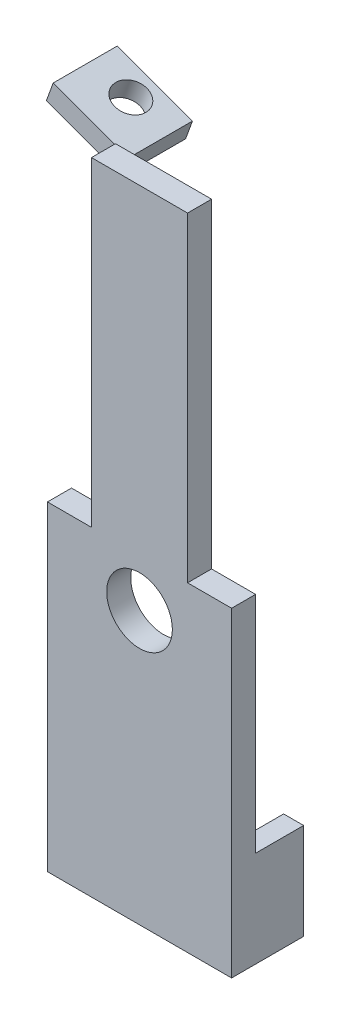
from build123d import *

# Parameters (mm, degrees)
SKETCH1_W           = 23
SKETCH1_H           = 40
BOSS_EXTRUDE1_DEPTH = 3
SKETCH2_R           = 4.1
CUT_EXTRUDE1_DEPTH  = 3
SKETCH3_W           = 12
SKETCH3_H           = 3
BOSS_EXTRUDE2_DEPTH = 40
SKETCH4_W           = 2.5
SKETCH4_H           = 12
BOSS_EXTRUDE3_DEPTH = 6
SKETCH6_W           = 8
SKETCH6_H           = 10
BOSS_EXTRUDE4_DEPTH = 2.5
SKETCH7_R           = 2
CUT_EXTRUDE2_DEPTH  = 78.511007161


with BuildPart() as part:
    # Sketch1 → Boss-Extrude1 (new body)
    with BuildSketch(Plane.XY):
        with Locations((0, 20)):
            Rectangle(SKETCH1_W, SKETCH1_H)
    extrude(amount=-BOSS_EXTRUDE1_DEPTH)

    # Sketch2 → Cut-Extrude1 (cut)
    with BuildSketch(Plane.XY):
        with Locations((0, 34)):
            Circle(SKETCH2_R)
    extrude(amount=-CUT_EXTRUDE1_DEPTH, mode=Mode.SUBTRACT)

    # Sketch3 → Boss-Extrude2 (add)
    with BuildSketch(Plane(origin=(0, 40, 0), x_dir=(1, 0, 0), z_dir=(0, 1, 0))):
        with Locations((0, 1.5)):
            Rectangle(SKETCH3_W, SKETCH3_H)
    extrude(amount=BOSS_EXTRUDE2_DEPTH)

    # Sketch4 → Boss-Extrude3 (add)
    with BuildSketch(Plane(origin=(0, 0, -3), x_dir=(-1, 0, 0), z_dir=(0, 0, -1))):
        with Locations((-10.25, 6)):
            Rectangle(SKETCH4_W, SKETCH4_H)
    extrude(amount=BOSS_EXTRUDE3_DEPTH)

    # Sketch6 → Boss-Extrude4 (add)
    with BuildSketch(Plane(origin=(24.104535363, 66.226666617, 0), x_dir=(0, 0, -1), z_dir=(0.34202014332566943, 0.9396926207859081, 0))):
        with Locations((7, 36.228956157)):
            Rectangle(SKETCH6_W, SKETCH6_H)
    extrude(amount=BOSS_EXTRUDE4_DEPTH)

    # Sketch7 → Cut-Extrude2 (cut, through all)
    with BuildSketch(Plane(origin=(24.104535363, 66.226666617, 0), x_dir=(0.9396926207859078, -0.3420201433256706, 0), z_dir=(-0.3420201433256706, -0.9396926207859078, 0))):
        with Locations((-36.228956157, -8)):
            Circle(SKETCH7_R)
    extrude(amount=-CUT_EXTRUDE2_DEPTH, mode=Mode.SUBTRACT)


solid = part.part
